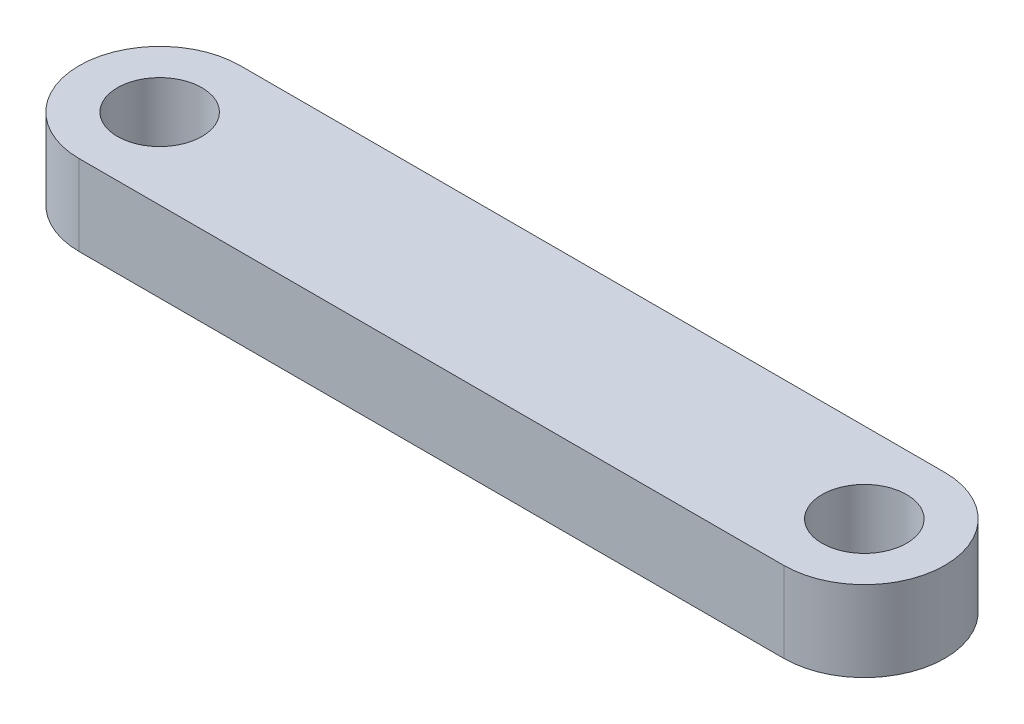
from build123d import *

# Parameters (mm, degrees)
SKETCH1_R           = 1.05
BOSS_EXTRUDE1_DEPTH = 2


with BuildPart() as part:
    # Sketch1 → Boss-Extrude1 (new body)
    with BuildSketch(Plane(origin=(0, 0, 0), x_dir=(1, 0, 0), z_dir=(0, 1, 0))):
        with BuildLine():
            Line((0, 2), (17.5, 2))
            ThreePointArc((17.5, 2), (19.5, 0), (17.5, -2))
            Line((17.5, -2), (0, -2))
            ThreePointArc((0, -2), (-2, 0), (0, 2))
        make_face()
        with Locations(Location((0, 0, 0), (0, 0, 270))):
            Circle(SKETCH1_R, mode=Mode.SUBTRACT)
        with Locations(Location((17.5, 0, 0), (0, 0, 270))):
            Circle(SKETCH1_R, mode=Mode.SUBTRACT)
    extrude(amount=BOSS_EXTRUDE1_DEPTH)


solid = part.part
